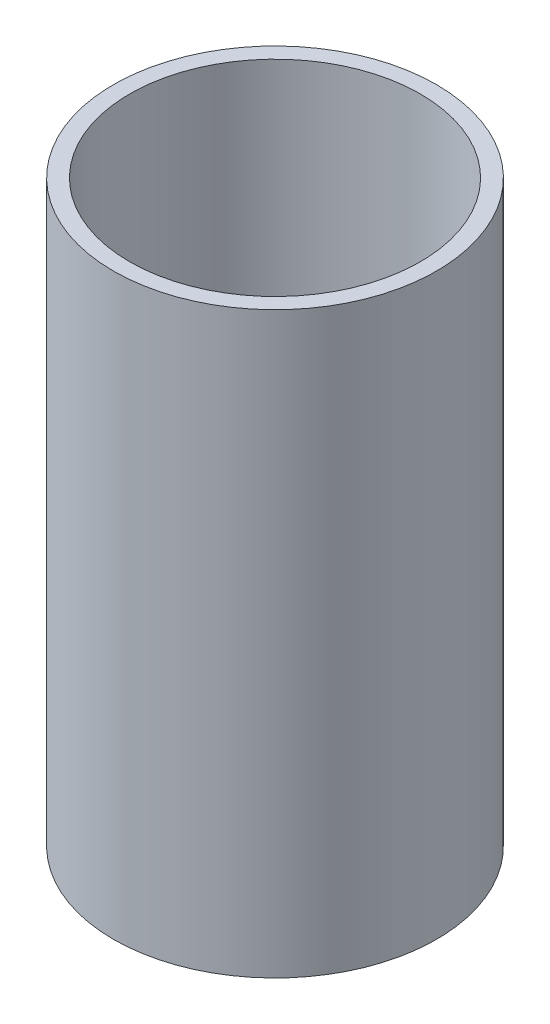
from build123d import *

# Parameters (mm, degrees)
SKETCH1_R                            = 20
BOSS_EXTRUDE1_DEPTH                  = 10
SKETCH1_R_2                          = 40
SKETCH1_R_3                          = 36
BOSS_EXTRUDE1_2_DEPTH                = 10
BOSS_EXTRUDE2_REACH                  = 89.446
BOSS_EXTRUDE2_END_RADIUS             = 36
BOSS_EXTRUDE2_START                  = 30
BOSS_EXTRUDE2_DIRECTION_2_REACH      = 89.446
BOSS_EXTRUDE2_DIRECTION_2_END_RADIUS = 20
CIRPATTERN1_COUNT                    = 12
SKETCH5_R                            = 1.735695499
BOSS_EXTRUDE3_DEPTH                  = 5
SCALE1_SCALE                         = 0.75
SKETCH6_R                            = 30
SKETCH6_R_2                          = 27
BOSS_EXTRUDE4_DEPTH                  = 100


with BuildPart() as part:
    # Sketch1 → Boss-Extrude1 (new body)
    with BuildSketch(Plane(origin=(0, 0, 0), x_dir=(1, 0, 0), z_dir=(0, 1, 0))):
        with Locations(Location((0, 0, 0), (0, 0, 270))):
            Circle(SKETCH1_R)
    extrude(amount=BOSS_EXTRUDE1_DEPTH)


with BuildPart() as body_2:
    # Sketch1 → Boss-Extrude1 2 (new body)
    with BuildSketch(Plane(origin=(0, 0, 0), x_dir=(1, 0, 0), z_dir=(0, 1, 0))):
        with Locations(Location((0, 0, 0), (0, 0, 270))):
            Circle(SKETCH1_R_2)
        with Locations(Location((0, 0, 0), (0, 0, 270))):
            Circle(SKETCH1_R_3, mode=Mode.SUBTRACT)
    extrude(amount=BOSS_EXTRUDE1_2_DEPTH)


    add(part.part)  # Boss-Extrude2 merges part
    # Boss-Extrude2: up to this cylinder (the profile starts inside it)
    boss_extrude2_end = Plane(origin=(0, 5, 0), z_dir=(0, -1, 0)) * Cylinder(BOSS_EXTRUDE2_END_RADIUS, 251.892, mode=Mode.PRIVATE)
    # Sketch4 → Boss-Extrude2 (add, up to the surface)
    with BuildSketch(Plane(origin=(0, 0, 0), x_dir=(0, 0, -1), z_dir=(1, 0, 0)).offset(BOSS_EXTRUDE2_START), mode=Mode.PRIVATE) as boss_extrude2_sk1:
        Polygon((-4.262410526, 0), (4.031443844, 10), (5.315133993, 10), (-2.978720377, 0), align=None)
    boss_extrude2_tool1 = extrude(boss_extrude2_sk1.sketch, amount=BOSS_EXTRUDE2_REACH, mode=Mode.PRIVATE) & boss_extrude2_end
    boss_extrude2 = boss_extrude2_tool1.solids().sort_by_distance((30, 5, -0.526362))[0]
    add(boss_extrude2)

    # Boss-Extrude2 direction 2: up to this cylinder (the profile starts outside it)
    boss_extrude2_direction_2_end = Plane(origin=(0, 5, 0), z_dir=(0, -1, 0)) * Cylinder(BOSS_EXTRUDE2_DIRECTION_2_END_RADIUS, 219.892, mode=Mode.PRIVATE)
    # Sketch4 → Boss-Extrude2 direction 2 (add, up to the surface)
    with BuildSketch(Plane(origin=(0, 0, 0), x_dir=(0, 0, -1), z_dir=(1, 0, 0)).offset(BOSS_EXTRUDE2_START), mode=Mode.PRIVATE) as boss_extrude2_direction_2_sk1:
        Polygon((-4.262410526, 0), (4.031443844, 10), (5.315133993, 10), (-2.978720377, 0), align=None)
    boss_extrude2_direction_2_tool1 = extrude(boss_extrude2_direction_2_sk1.sketch, amount=-BOSS_EXTRUDE2_DIRECTION_2_REACH, mode=Mode.PRIVATE) - boss_extrude2_direction_2_end
    boss_extrude2_direction_2 = boss_extrude2_direction_2_tool1.solids().sort_by_distance((30, 5, -0.526362))[0]
    add(boss_extrude2_direction_2)
    boss_extrude2 = boss_extrude2 + boss_extrude2_direction_2  # both directions under the feature's name, for the pattern or mirror that repeats it

    # CirPattern1: Boss-Extrude2 ×12 about axis
    cirpattern1_axis = Axis((0, 0, 0), (0, 1, 0))
    for i in range(1, CIRPATTERN1_COUNT):
        add(boss_extrude2.rotate(cirpattern1_axis, i * 360 / CIRPATTERN1_COUNT))

    # Sketch5 → Boss-Extrude3 (add)
    with BuildSketch(Plane(origin=(0, 10, 0), x_dir=(1, 0, 0), z_dir=(0, 1, 0))):
        with Locations(Location((-14.887021655, 0, 0), (0, 0, 270))):
            Circle(SKETCH5_R)
        with Locations(Location((-7.443510827, 12.89253894, 0), (0, 0, 270))):
            Circle(SKETCH5_R)
        with Locations(Location((7.443510827, 12.89253894, 0), (0, 0, 270))):
            Circle(SKETCH5_R)
        with Locations(Location((14.887021655, 0, 0), (0, 0, 270))):
            Circle(SKETCH5_R)
        with Locations(Location((7.443510827, -12.89253894, 0), (0, 0, 270))):
            Circle(SKETCH5_R)
        with Locations(Location((-7.443510827, -12.89253894, 0), (0, 0, 270))):
            Circle(SKETCH5_R)
    extrude(amount=BOSS_EXTRUDE3_DEPTH)


with BuildPart() as body_2_1:
    # Scale1: scaled about (0, 0, 0)
    add(body_2.part.scale(SCALE1_SCALE))

    # Sketch6 → Boss-Extrude4 (add)
    with BuildSketch(Plane(origin=(0, 7.5, 0), x_dir=(1, 0, 0), z_dir=(0, 1, 0))):
        with Locations(Location((0, 0, 0), (0, 0, 270))):
            Circle(SKETCH6_R)
        with Locations(Location((0, 0, 0), (0, 0, 85.253793096))):
            Circle(SKETCH6_R_2, mode=Mode.SUBTRACT)
    extrude(amount=BOSS_EXTRUDE4_DEPTH)


solid = body_2_1.part
